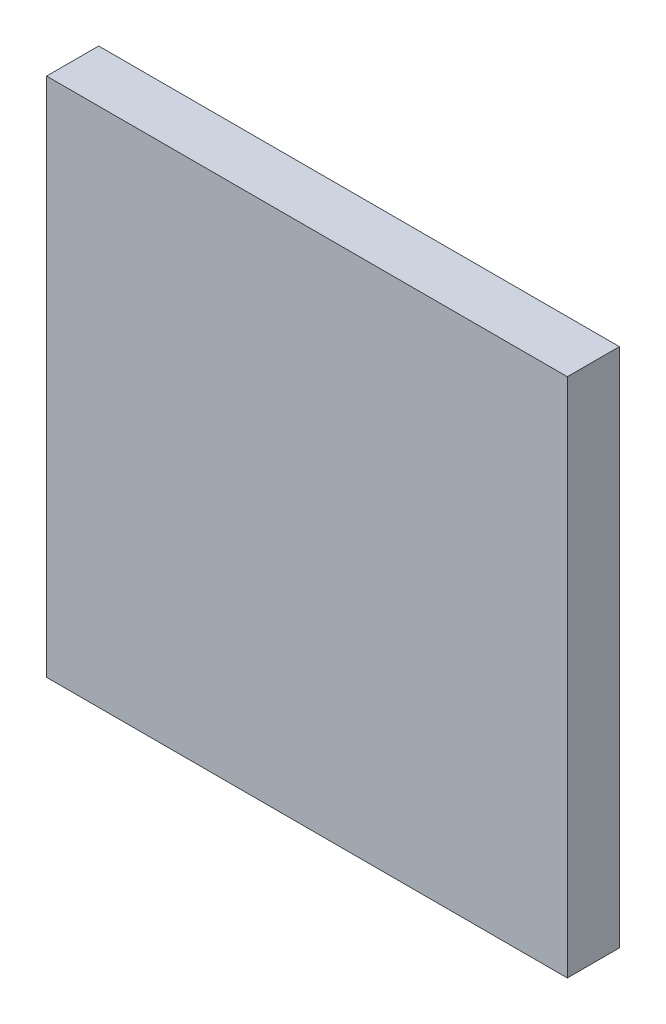
from build123d import *

# Parameters (mm, degrees)
CROQUIS1_W              = 150
CROQUIS1_H              = 150
SALIENTE_EXTRUIR1_DEPTH = 15


with BuildPart() as part:
    # Croquis1 → Saliente-Extruir1 (new body)
    with BuildSketch(Plane.XY):
        with Locations((31.802721088, -46.598639456)):
            Rectangle(CROQUIS1_W, CROQUIS1_H)
    extrude(amount=SALIENTE_EXTRUIR1_DEPTH)


solid = part.part
